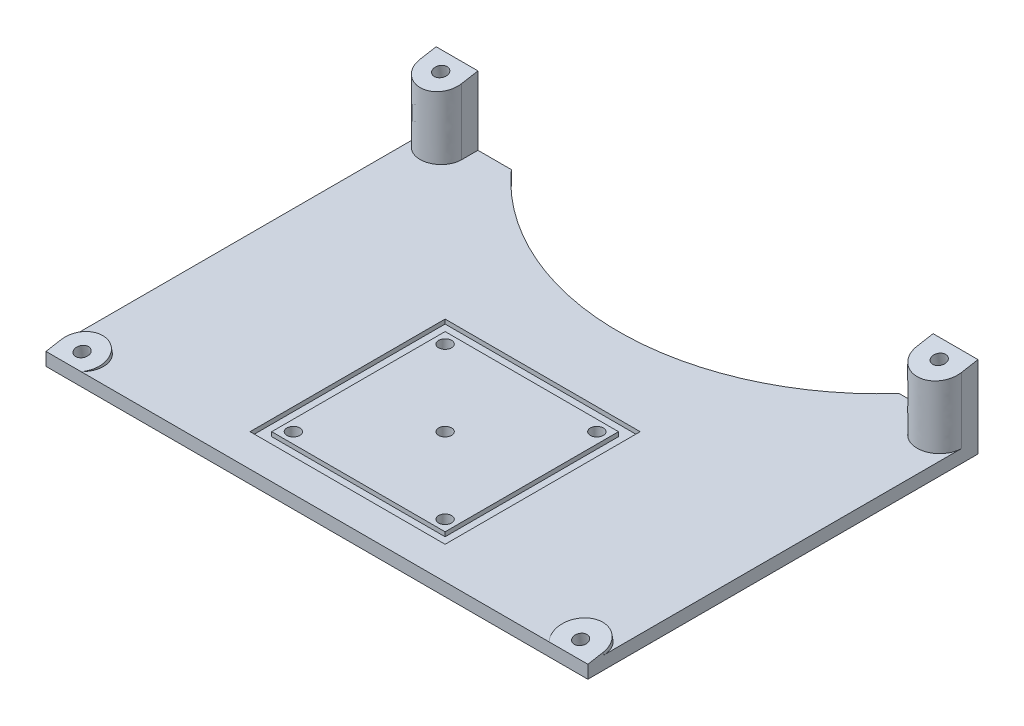
from build123d import *

# Parameters (mm, degrees)
SKETCH_1_W                        = 125
SKETCH_1_H                        = 90
EXTRUDE_1_DEPTH                   = 3
EXTRUDE_2_DEPTH                   = 125
SKETCH_4_R                        = 1.5
CUT_EXTRUDE_1_DEPTH               = 79.83849136
CUT_EXTRUDE_2_REACH               = 83.838
CUT_EXTRUDE_2_OFFSET_FROM_SURFACE = 3
SKETCH_7_R                        = 1.5
CUT_EXTRUDE_3_DEPTH               = 79.632618889
SKETCH_8_W                        = 45
SKETCH_8_H                        = 45
SKETCH_8_W_2                      = 40
SKETCH_8_H_2                      = 40
CUT_EXTRUDE_4_DEPTH               = 1
EXTRUDE_5_REACH                   = 80.633
SKETCH_13_R                       = 1.5
CUT_EXTRUDE_6_DEPTH               = 12
SKETCH_14_R                       = 60
CUT_EXTRUDE_11_DEPTH              = 10


with BuildPart() as part:
    # 草图1 → 凸台-拉伸1 (new body)
    with BuildSketch(Plane(origin=(0, 0, 0), x_dir=(1, 0, 0), z_dir=(0, 1, 0))):
        Rectangle(SKETCH_1_W, SKETCH_1_H)
    extrude(amount=EXTRUDE_1_DEPTH)

    # 草图3 → 凸台-拉伸2 (add)
    with BuildSketch(Plane(origin=(62.5, 0, 0), x_dir=(0, 0, -1), z_dir=(1, 0, 0))):
        Polygon((-45, 3), (45, 18.869428264), (45, 3), align=None)
    extrude(amount=-EXTRUDE_2_DEPTH)

    # 草图4 → 切除-拉伸1 (cut, through all)
    with BuildSketch(Plane(origin=(0, 10.604992156, 1.869946247), x_dir=(1, 0, 0), z_dir=(0, 0.9848077530122079, 0.1736481776669313))):
        with Locations(Location((-57.677629218, 43.768927189, 0), (0, 0, 270))):
            Circle(SKETCH_4_R)
        with Locations(Location((-57.677629218, -40.231072811, 0), (0, 0, 270))):
            Circle(SKETCH_4_R)
        with Locations(Location((57.322370782, -40.231072811, 0), (0, 0, 270))):
            Circle(SKETCH_4_R)
        with Locations(Location((57.322370782, 43.768927189, 0), (0, 0, 270))):
            Circle(SKETCH_4_R)
    extrude(amount=-CUT_EXTRUDE_1_DEPTH, mode=Mode.SUBTRACT)

    # 切除-拉伸2: up to this face of the body (flat: up to its plane, moved by the offset)
    cut_extrude_2_end = Plane(part.part.faces().sort_by_distance((0.00039232, 0, -0.011252097))[0]).offset(-CUT_EXTRUDE_2_OFFSET_FROM_SURFACE)
    # 草图6 → 切除-拉伸2 (cut, up to the picked face)
    with BuildSketch(Plane(origin=(0, 10.604992156, 1.869946247), x_dir=(1, 0, 0), z_dir=(0, 0.9848077530122079, 0.1736481776669313)), mode=Mode.PRIVATE) as cut_extrude_2_sk1:
        with BuildLine():
            Line((-62.5, 43.768927189), (-62.5, -40.231072811))
            ThreePointArc((-62.5, -40.231072811), (-55.729394488, -35.819764457), (-54.429429622, -43.795404353))
            Line((-54.429429622, -43.795404353), (53.566923407, -43.795404353))
            ThreePointArc((53.566923407, -43.795404353), (55.403578158, -35.422114588), (62.5, -40.231072811))
            Line((62.5, -40.231072811), (62.5, 43.768927189))
            ThreePointArc((62.5, 43.768927189), (55.232545192, 39.031789517), (53.831757304, 47.592990717))
            Line((53.831757304, 47.592990717), (-54.739637032, 47.592990717))
            ThreePointArc((-54.739637032, 47.592990717), (-55.54606028, 39.44322796), (-62.5, 43.768927189))
        make_face()
    cut_extrude_2_tool1 = split(extrude(cut_extrude_2_sk1.sketch, amount=-CUT_EXTRUDE_2_REACH, mode=Mode.PRIVATE), bisect_by=cut_extrude_2_end, keep=Keep.BOTH, mode=Mode.PRIVATE)
    add(cut_extrude_2_tool1.solids().sort_by(Axis((-0.081778, 10.93222, 0.014148), (0, -0.9848077530122079, -0.1736481776669313)))[0], mode=Mode.SUBTRACT)

    # 草图7 → 切除-拉伸3 (cut, through all)
    with BuildSketch(Plane(origin=(0, 3, 0), x_dir=(1, 0, 0), z_dir=(0, 1, 0))):
        with Locations(Location((-17.931253107, 2.5, 0), (0, 0, 270))):
            Circle(SKETCH_7_R)
        with Locations(Location((-17.931253107, -32.5, 0), (0, 0, 270))):
            Circle(SKETCH_7_R)
        with Locations(Location((17.068746893, 2.5, 0), (0, 0, 270))):
            Circle(SKETCH_7_R)
        with Locations(Location((17.068746893, -32.5, 0), (0, 0, 270))):
            Circle(SKETCH_7_R)
        with Locations(Location((-0.431253107, -15, 0), (0, 0, 270))):
            Circle(SKETCH_7_R)
    extrude(amount=-CUT_EXTRUDE_3_DEPTH, mode=Mode.SUBTRACT)

    # 草图8 → 切除-拉伸4 (cut)
    with BuildSketch(Plane(origin=(0, 3, 0), x_dir=(1, 0, 0), z_dir=(0, 1, 0))):
        with Locations((-0.431253107, -15)):
            Rectangle(SKETCH_8_W, SKETCH_8_H)
        with Locations((-0.431253107, -15)):
            Rectangle(SKETCH_8_W_2, SKETCH_8_H_2, mode=Mode.SUBTRACT)
    extrude(amount=-CUT_EXTRUDE_4_DEPTH, mode=Mode.SUBTRACT)

    # 凸台-拉伸5: up to this plane
    extrude_5_end = Plane(origin=(-153.88839507, 3, 45), z_dir=(0, 0.984807753012208, 0.17364817766693127))
    # 草图10 → 凸台-拉伸5 (add, up to the surface)
    with BuildSketch(Plane(origin=(0, 3, 0), x_dir=(1, 0, 0), z_dir=(0, 1, 0)), mode=Mode.PRIVATE) as extrude_5_sk1:
        with BuildLine():
            Line((-52.855258436, 41.234032589), (-52.855258436, 45))
            Line((-52.855258436, 45), (-62.5, 45))
            Line((-62.5, 45), (-62.5, 41.234032589))
            add(Edge.make_bspline(
                [(-62.5, 41.234032589), (-62.5, 36.484924456), (-57.677629218, 36.484924456), (-52.855258436, 36.484924456), (-52.855258436, 41.234032589)],
                knots=[3.141592654, 3.141592654, 3.141592654, 4.71238898, 4.71238898, 6.283185307, 6.283185307, 6.283185307], degree=2, weights=[1, 0.707106781, 1, 0.707106781, 1]))
        make_face()
    extrude_5_tool1 = split(extrude(extrude_5_sk1.sketch, amount=EXTRUDE_5_REACH, mode=Mode.PRIVATE), bisect_by=extrude_5_end, keep=Keep.BOTH, mode=Mode.PRIVATE)
    add(extrude_5_tool1.solids().sort_by_distance((-57.677629, 3, -41.177434))[0])
    # 草图10 → 凸台-拉伸5 (add, up to the surface)
    with BuildSketch(Plane(origin=(0, 3, 0), x_dir=(1, 0, 0), z_dir=(0, 1, 0)), mode=Mode.PRIVATE) as extrude_5_sk2:
        with BuildLine():
            Line((52.144741564, 41.234032589), (52.144741564, 45))
            Line((52.144741564, 45), (62.5, 45))
            Line((62.5, 45), (62.5, 41.234032589))
            add(Edge.make_bspline(
                [(52.144741564, 41.234032589), (52.144741564, 36.135063193), (57.322370782, 36.135063193), (62.5, 36.135063193), (62.5, 41.234032589)],
                knots=[3.141592654, 3.141592654, 3.141592654, 4.71238898, 4.71238898, 6.283185307, 6.283185307, 6.283185307], degree=2, weights=[1, 0.707106781, 1, 0.707106781, 1]))
        make_face()
    extrude_5_tool2 = split(extrude(extrude_5_sk2.sketch, amount=EXTRUDE_5_REACH, mode=Mode.PRIVATE), bisect_by=extrude_5_end, keep=Keep.BOTH, mode=Mode.PRIVATE)
    add(extrude_5_tool2.solids().sort_by_distance((57.322371, 3, -41.031678))[0])

    # 草图13 → 切除-拉伸6 (cut)
    with BuildSketch(Plane(origin=(0, 10.604992156, 1.869946247), x_dir=(1, 0, 0), z_dir=(0, 0.9848077530122079, 0.1736481776669313))):
        with Locations(Location((-57.677629218, 43.768927189, 0), (0, 0, 270))):
            Circle(SKETCH_13_R)
        with Locations(Location((57.322370782, 43.768927189, 0), (0, 0, 270))):
            Circle(SKETCH_13_R)
    extrude(amount=-CUT_EXTRUDE_6_DEPTH, mode=Mode.SUBTRACT)

    # 草图14 → 切除-拉伸11 (cut)
    with BuildSketch(Plane(origin=(0, 3, 0), x_dir=(1, 0, 0), z_dir=(0, 1, 0))):
        with Locations((-0.431253107, 85)):
            Circle(SKETCH_14_R)
    extrude(amount=-CUT_EXTRUDE_11_DEPTH, mode=Mode.SUBTRACT)


solid = part.part
